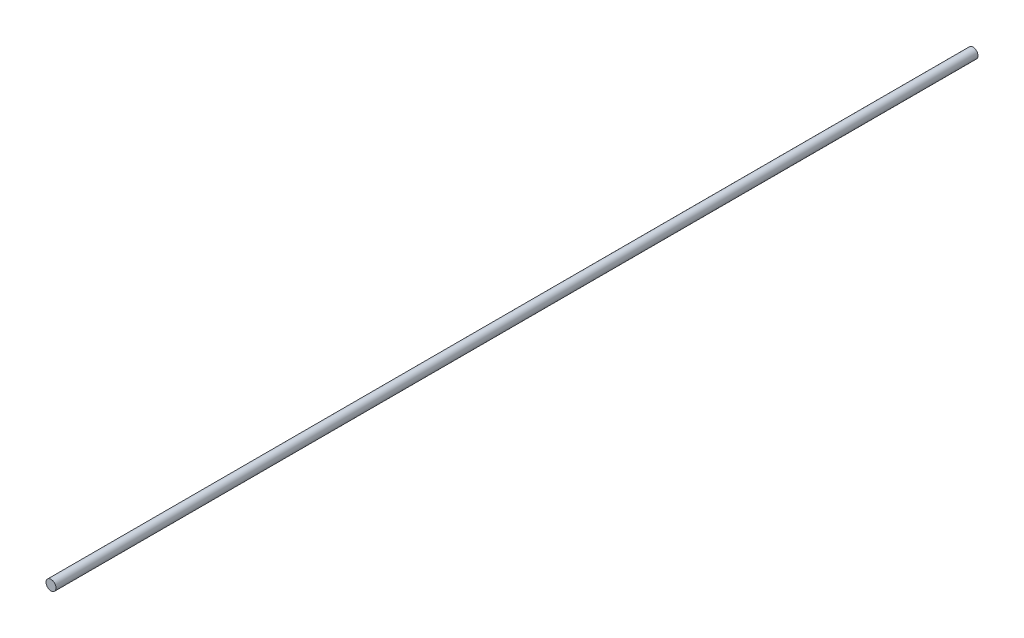
from build123d import *

# Parameters (mm, degrees)
SKETCH1_R           = 7.9375
BOSS_EXTRUDE1_DEPTH = 2254.25
SKETCH2_R           = 7.9375
CUT_EXTRUDE1_DEPTH  = 539.75
CUT_EXTRUDE2_START  = -254
SKETCH3_R           = 7.9375
CUT_EXTRUDE2_DEPTH  = 254


with BuildPart() as part:
    # Sketch1 → Boss-Extrude1 (new body)
    with BuildSketch(Plane.XY):
        Circle(SKETCH1_R)
    extrude(amount=BOSS_EXTRUDE1_DEPTH)

    # Sketch2 → Cut-Extrude1 (cut)
    with BuildSketch(Plane(origin=(0, 0, 0), x_dir=(-1, 0, 0), z_dir=(0, 0, -1))):
        Circle(SKETCH2_R)
    extrude(amount=-CUT_EXTRUDE1_DEPTH, mode=Mode.SUBTRACT)

    # Sketch3 → Cut-Extrude2 (cut)
    with BuildSketch(Plane.XY.offset(2254.25).offset(CUT_EXTRUDE2_START)):
        with Locations(Location((0, 0, 0), (0, 0, 180))):
            Circle(SKETCH3_R)
    extrude(amount=CUT_EXTRUDE2_DEPTH, mode=Mode.SUBTRACT)


solid = part.part
